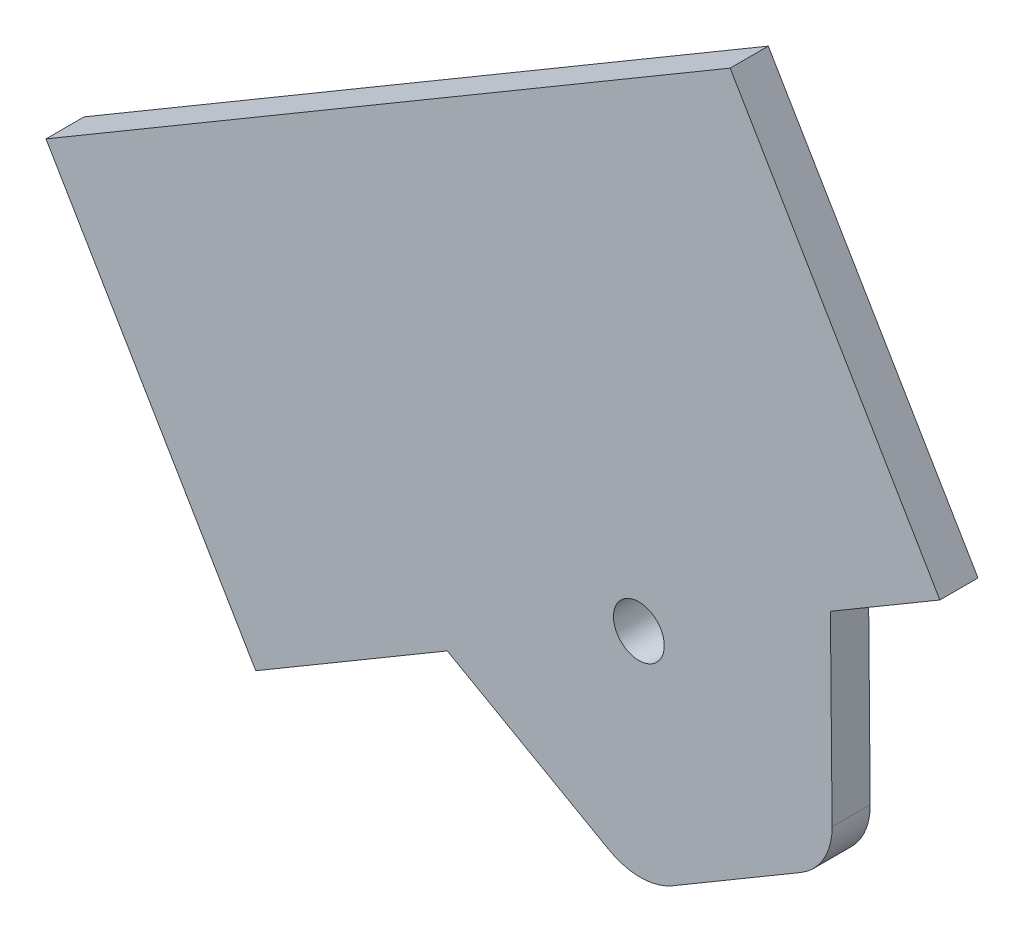
from build123d import *

# Parameters (mm, degrees)
SKETCH1_R           = 4
BOSS_EXTRUDE1_DEPTH = 6


with BuildPart() as part:
    # Sketch1 → Boss-Extrude1 (new body)
    with BuildSketch(Plane.XY):
        with BuildLine():
            Line((62.675802399, 442.096939002), (95.687041803, 386.103563742))
            Line((95.687041803, 386.103563742), (78.458310953, 375.94625931))
            Line((78.458310953, 375.94625931), (78.724444877, 346.720973723))
            ThreePointArc((78.724444877, 346.720973723), (77.430284022, 341.708981412), (73.80351169, 338.015549175))
            Line((73.80351169, 338.015549175), (53.600245097, 326.104588867))
            ThreePointArc((53.600245097, 326.104588867), (48.612652005, 324.719368889), (43.600659694, 326.013529744))
            Line((43.600659694, 326.013529744), (18.157752981, 340.395693799))
            Line((18.157752981, 340.395693799), (-11.992526005, 322.620411043))
            Line((-11.992526005, 322.620411043), (-45.003765409, 378.613786303))
            Line((-45.003765409, 378.613786303), (62.675802399, 442.096939002))
        make_face()
        with Locations((48.308031967, 358.170976554)):
            Circle(SKETCH1_R, mode=Mode.SUBTRACT)
    extrude(amount=BOSS_EXTRUDE1_DEPTH)


solid = part.part
